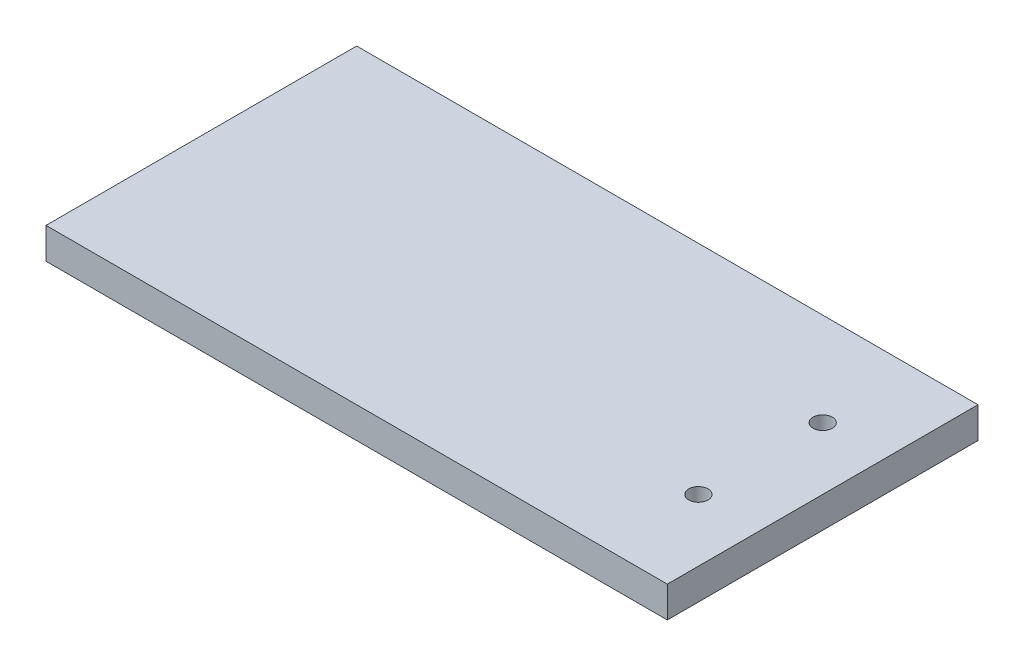
from build123d import *

# Parameters (mm, degrees)
ESQUISSE1_W                                    = 200
ESQUISSE1_H                                    = 100
BOSS_EXTRU_1_DEPTH                             = 10
FRAISAGE_POUR_VIS_T_TE_FRAIS_E_M61_D           = 6.2
FRAISAGE_POUR_VIS_T_TE_FRAIS_E_M61_CSINK_D     = 12.6
FRAISAGE_POUR_VIS_T_TE_FRAIS_E_M61_CSINK_ANGLE = 90


with BuildPart() as part:
    # Esquisse1 → Boss.-Extru.1 (new body)
    with BuildSketch(Plane(origin=(0, 0, 0), x_dir=(1, 0, 0), z_dir=(0, 1, 0))):
        Rectangle(ESQUISSE1_W, ESQUISSE1_H)
    extrude(amount=BOSS_EXTRU_1_DEPTH)

    # Fraisage pour vis à tête fraisée M61 (through all)
    with Locations(Plane(origin=(0, 0, 0), x_dir=(-1, 0, 0), z_dir=(0, -1, 0))):
        with Locations((-80, 20), (-80, -20)):
            CounterSinkHole(FRAISAGE_POUR_VIS_T_TE_FRAIS_E_M61_D / 2, FRAISAGE_POUR_VIS_T_TE_FRAIS_E_M61_CSINK_D / 2, counter_sink_angle=FRAISAGE_POUR_VIS_T_TE_FRAIS_E_M61_CSINK_ANGLE)


solid = part.part
